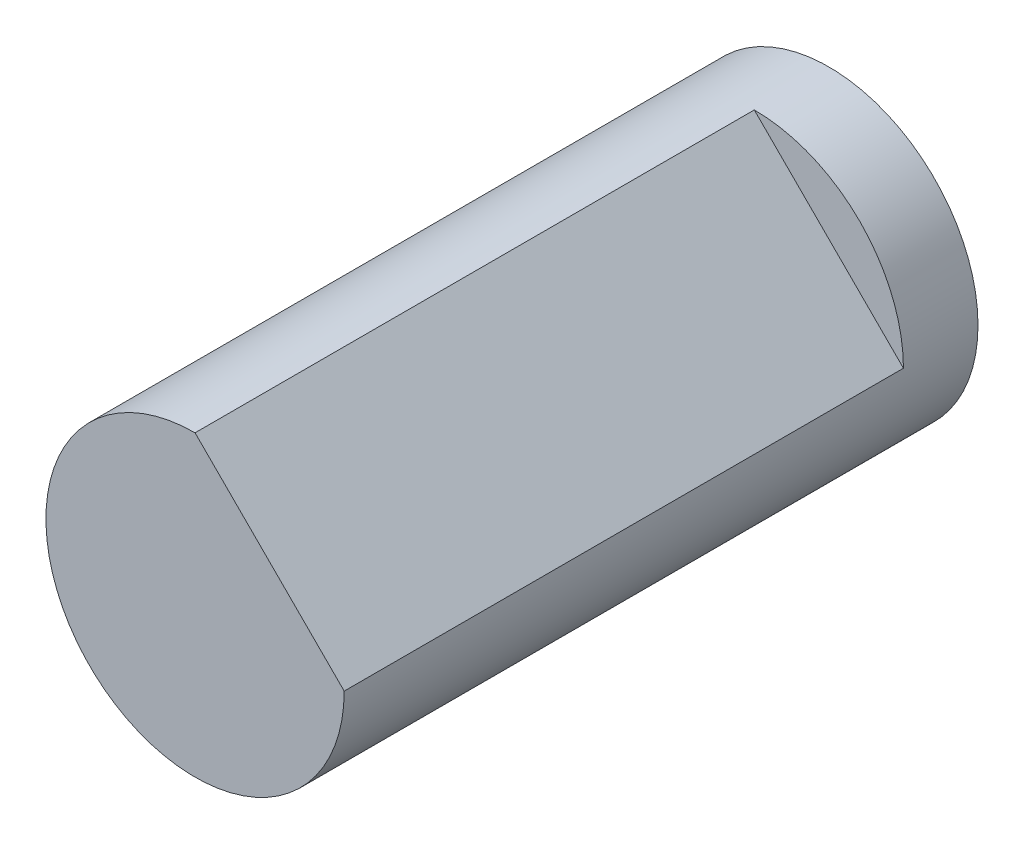
from build123d import *

# Parameters (mm, degrees)
SKETCH1_R           = 4
BOSS_EXTRUDE1_DEPTH = 17
CUT_EXTRUDE1_DEPTH  = 15


with BuildPart() as part:
    # Sketch1 → Boss-Extrude1 (new body)
    with BuildSketch(Plane.XY):
        Circle(SKETCH1_R)
    extrude(amount=BOSS_EXTRUDE1_DEPTH)

    # Sketch2 → Cut-Extrude1 (cut)
    with BuildSketch(Plane.XY.offset(17)):
        Polygon((4, 0), (0, 4), (1.431984917, 5.431984917), (5.431984917, 1.431984917), align=None)
    extrude(amount=-CUT_EXTRUDE1_DEPTH, mode=Mode.SUBTRACT)


solid = part.part
